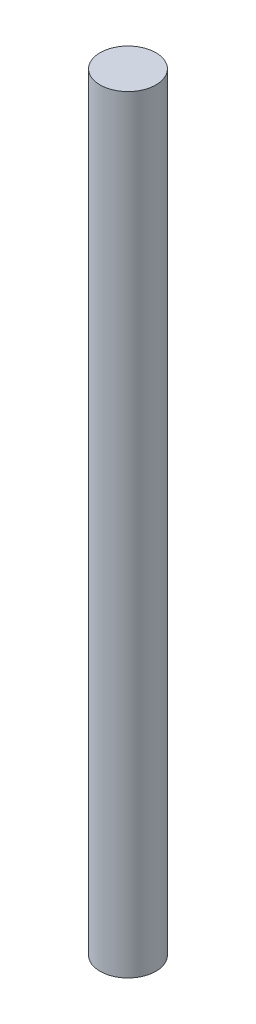
from build123d import *

# Parameters (mm, degrees)
SKETCH1_R           = 0.8
BOSS_EXTRUDE1_DEPTH = 22


with BuildPart() as part:
    # Sketch1 → Boss-Extrude1 (new body)
    with BuildSketch(Plane(origin=(0, 0, 0), x_dir=(1, 0, 0), z_dir=(0, 1, 0))):
        with Locations(Location((0, 0, 0), (0, 0, 270))):
            Circle(SKETCH1_R)
    extrude(amount=BOSS_EXTRUDE1_DEPTH)


solid = part.part
